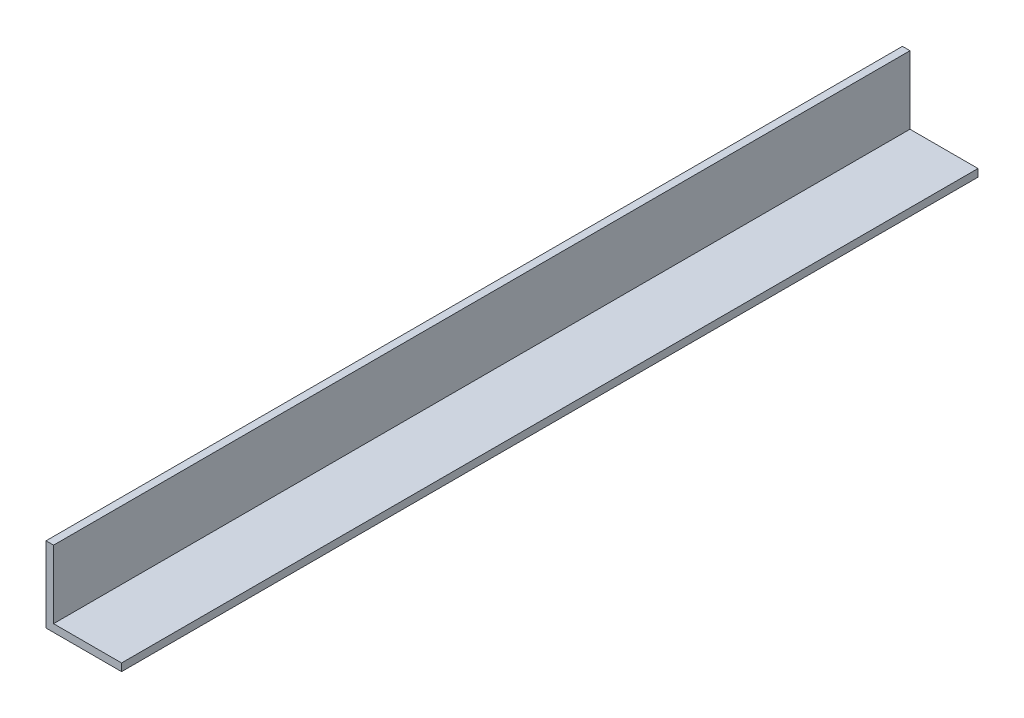
from build123d import *

# Parameters (mm, degrees)
ESTRUSIONE_ESTRUSIONE1_DEPTH = 340


with BuildPart() as part:
    # Schizzo1 → Estrusione-Estrusione1 (new body)
    with BuildSketch(Plane.XY):
        Polygon((0, 30), (0, 0), (30, 0), (30, 3), (3, 3), (3, 30), align=None)
    extrude(amount=ESTRUSIONE_ESTRUSIONE1_DEPTH)


solid = part.part
